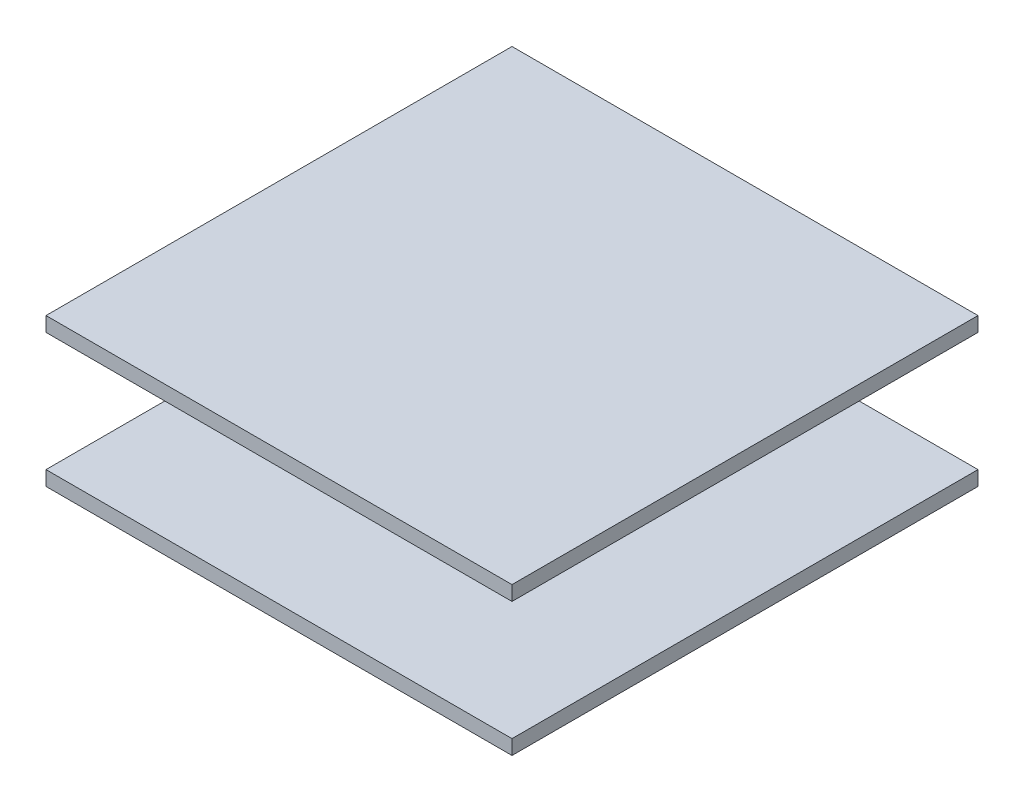
from build123d import *

# Parameters (mm, degrees)
SKETCH2_W           = 51
SKETCH2_H           = 51
BOSS_EXTRUDE1_DEPTH = 1.6
BOSS_EXTRUDE2_START = 13
SKETCH4_W           = 51
SKETCH4_H           = 51
BOSS_EXTRUDE2_DEPTH = 1.6


with BuildPart() as part:
    # Sketch2 → Boss-Extrude1 (new body)
    with BuildSketch(Plane(origin=(0, 0, 0), x_dir=(1, 0, 0), z_dir=(0, 1, 0))):
        Rectangle(SKETCH2_W, SKETCH2_H)
    extrude(amount=-BOSS_EXTRUDE1_DEPTH)


with BuildPart() as body_2:
    # Sketch4 → Boss-Extrude2 (new body)
    with BuildSketch(Plane(origin=(0, 0, 0), x_dir=(1, 0, 0), z_dir=(0, 1, 0)).offset(BOSS_EXTRUDE2_START)):
        Rectangle(SKETCH4_W, SKETCH4_H)
    extrude(amount=BOSS_EXTRUDE2_DEPTH)


solid = Compound([part.part, body_2.part])
